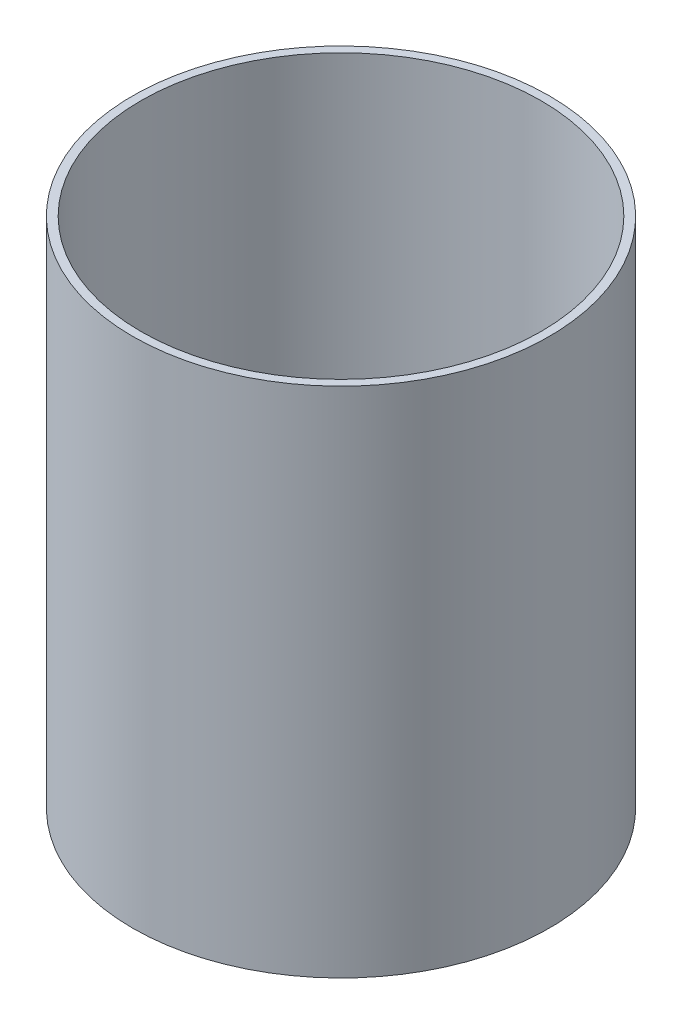
from build123d import *

# Parameters (mm, degrees)
SKETCH_1_R      = 50
SKETCH_1_R_2    = 48
EXTRUDE_1_DEPTH = 123


with BuildPart() as part:
    # Эскиз1 → Бобышка-Вытянуть1 (new body)
    with BuildSketch(Plane(origin=(0, 0, 0), x_dir=(1, 0, 0), z_dir=(0, 1, 0))):
        with Locations(Location((0, 0, 0), (0, 0, 270))):
            Circle(SKETCH_1_R)
        with Locations(Location((0, 0, 0), (0, 0, 270))):
            Circle(SKETCH_1_R_2, mode=Mode.SUBTRACT)
    extrude(amount=EXTRUDE_1_DEPTH)


solid = part.part
